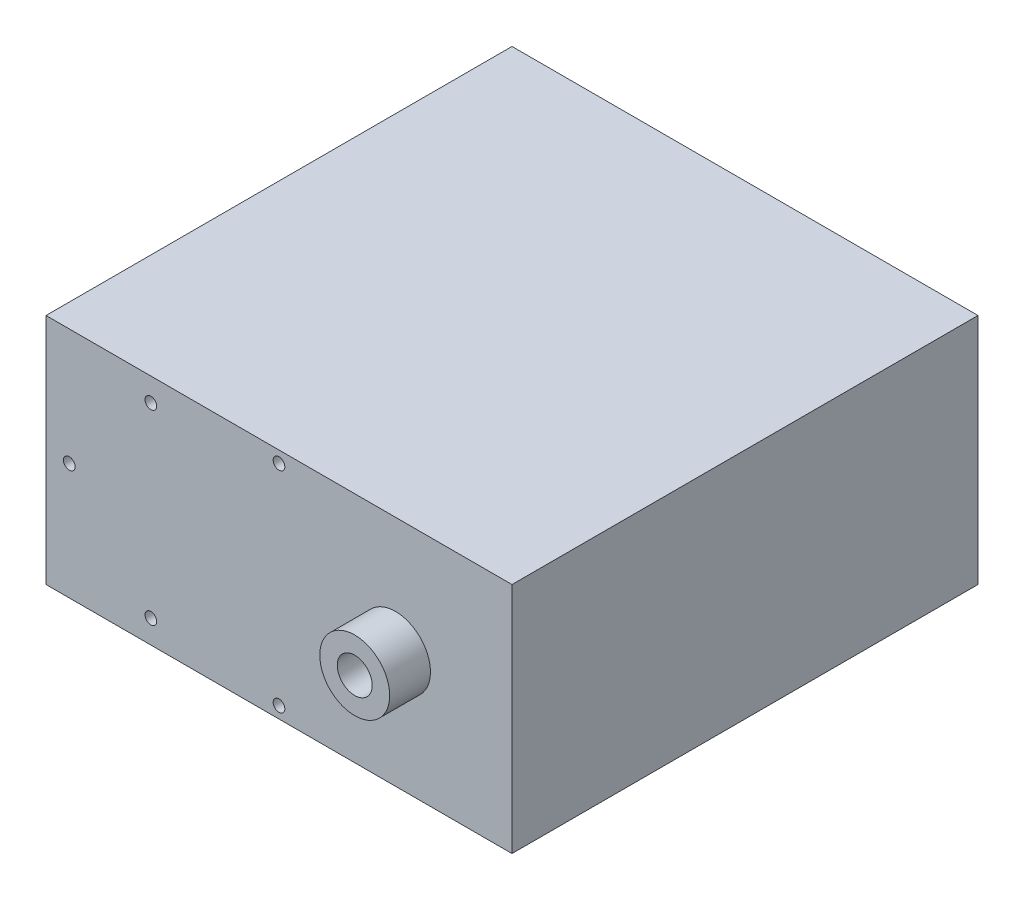
from build123d import *

# Parameters (mm, degrees)
SKETCH_1_W          = 40
SKETCH_1_H          = 20
EXTRUDE_1_DEPTH     = 40
SKETCH_2_R          = 3
SKETCH_2_R_2        = 1.5
EXTRUDE_2_DEPTH     = 3.5
SKETCH_3_R          = 6
EXTRUDE_3_DEPTH     = 1
EXTRUDE_START       = 6
SKETCH_4_R          = 3
SKETCH_4_R_2        = 1
EXTRUDE_4_DEPTH     = 6
SKETCH_5_R          = 0.5
CUT_EXTRUDE_1_DEPTH = 10
CUT_EXTRUDE_START   = -10
SKETCH_6_R          = 0.5
CUT_EXTRUDE_2_DEPTH = 10


with BuildPart() as part:
    # 草图1 → 凸台-拉伸1 (new body)
    with BuildSketch(Plane.XY):
        Rectangle(SKETCH_1_W, SKETCH_1_H)
    extrude(amount=EXTRUDE_1_DEPTH)

    # 草图2 → 凸台-拉伸2 (add)
    with BuildSketch(Plane.XY.offset(40)):
        with Locations(Location((10, 0, 0), (0, 0, 180))):
            Circle(SKETCH_2_R)
        with Locations((10, 0)):
            Circle(SKETCH_2_R_2, mode=Mode.SUBTRACT)
    extrude(amount=EXTRUDE_2_DEPTH)

    # 草图3 → 凸台-拉伸3 (add)
    with BuildSketch(Plane(origin=(0, 0, 0), x_dir=(-1, 0, 0), z_dir=(0, 0, -1))):
        with Locations((-10, 0)):
            Circle(SKETCH_3_R)
    extrude(amount=EXTRUDE_3_DEPTH)

    # 草图4 → 凸台-拉伸4 (add)
    with BuildSketch(Plane(origin=(0, 0, -1), x_dir=(-1, 0, 0), z_dir=(0, 0, -1)).offset(EXTRUDE_START)):
        with Locations((-10, 0)):
            Circle(SKETCH_4_R)
        with Locations((-10, 0)):
            Circle(SKETCH_4_R_2, mode=Mode.SUBTRACT)
    extrude(amount=-EXTRUDE_4_DEPTH)

    # 草图5 → 切除-拉伸1 (cut)
    with BuildSketch(Plane.XY.offset(40)):
        with Locations((-18, 0)):
            Circle(SKETCH_5_R)
        with Locations((-11, 8)):
            Circle(SKETCH_5_R)
        with Locations((0, 9)):
            Circle(SKETCH_5_R)
        with Locations((-11, -8)):
            Circle(SKETCH_5_R)
        with Locations((0, -9)):
            Circle(SKETCH_5_R)
    extrude(amount=-CUT_EXTRUDE_1_DEPTH, mode=Mode.SUBTRACT)

    # 草图6 → 切除-拉伸2 (cut)
    with BuildSketch(Plane(origin=(0, 0, 0), x_dir=(-1, 0, 0), z_dir=(0, 0, -1)).offset(CUT_EXTRUDE_START)):
        with Locations(Location((18, 0, 0), (0, 0, 180))):
            Circle(SKETCH_6_R)
        with Locations(Location((11, -8, 0), (0, 0, 180))):
            Circle(SKETCH_6_R)
        with Locations(Location((0, -9, 0), (0, 0, 180))):
            Circle(SKETCH_6_R)
        with Locations(Location((11, 8, 0), (0, 0, 180))):
            Circle(SKETCH_6_R)
        with Locations(Location((0, 9, 0), (0, 0, 180))):
            Circle(SKETCH_6_R)
    extrude(amount=CUT_EXTRUDE_2_DEPTH, mode=Mode.SUBTRACT)


solid = part.part
